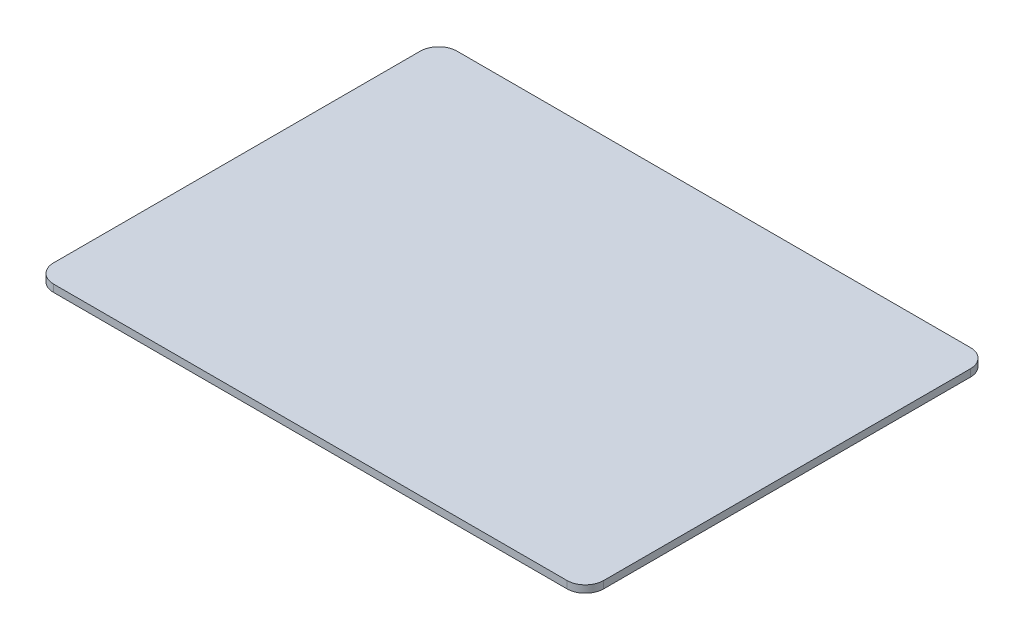
from build123d import *

# Parameters (mm, degrees)
BOSS_EXTRUDE1_DEPTH = 0.79375


with BuildPart() as part:
    # Sketch1 → Boss-Extrude1 (new body)
    with BuildSketch(Plane(origin=(0, 0, 0), x_dir=(1, 0, 0), z_dir=(0, 1, 0))):
        with BuildLine():
            Line((28, -22), (-28, -22))
            ThreePointArc((-28, -22), (-29.414213562, -21.414213562), (-30, -20))
            Line((-30, -20), (-30, 20))
            ThreePointArc((-30, 20), (-29.414213562, 21.414213562), (-28, 22))
            Line((-28, 22), (28, 22))
            ThreePointArc((28, 22), (29.414213562, 21.414213562), (30, 20))
            Line((30, 20), (30, -20))
            ThreePointArc((30, -20), (29.414213562, -21.414213562), (28, -22))
        make_face()
    extrude(amount=BOSS_EXTRUDE1_DEPTH)


solid = part.part
